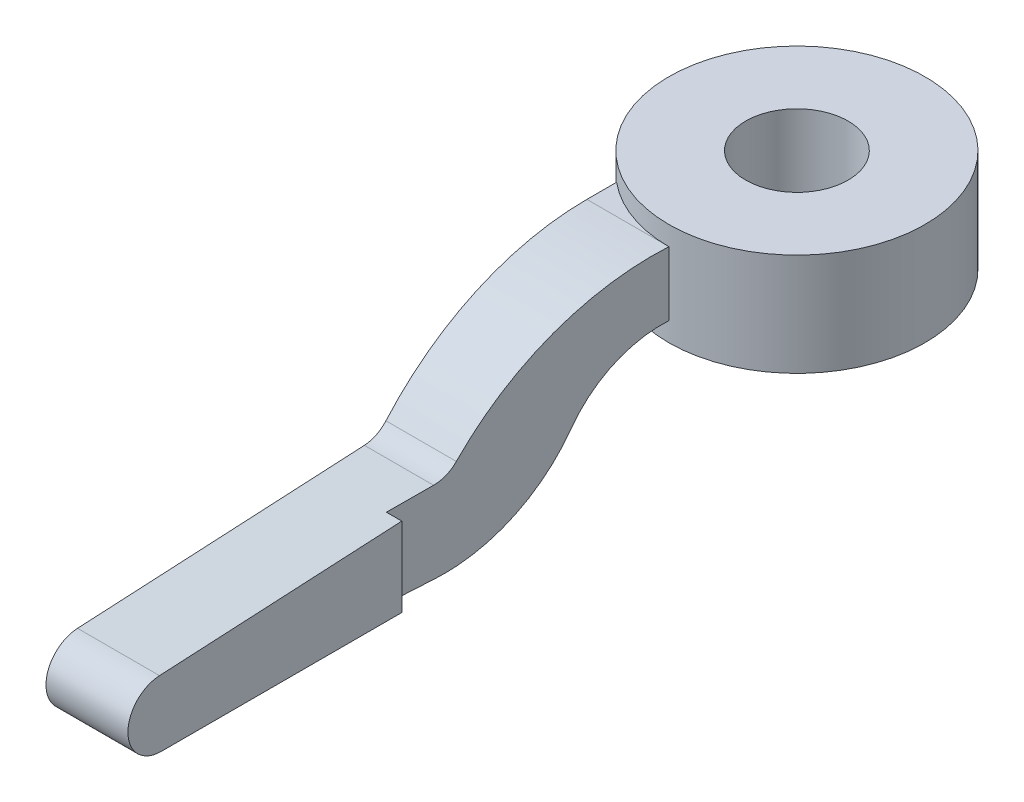
from build123d import *

# Parameters (mm, degrees)
SKETCH1_R           = 2.5
SKETCH1_R_2         = 1
BOSS_EXTRUDE1_DEPTH = 2
BOSS_EXTRUDE2_DEPTH = 0.8
CUT_EXTRUDE1_DEPTH  = 14.872182458


with BuildPart() as part:
    # Sketch1 → Boss-Extrude1 (new body)
    with BuildSketch(Plane(origin=(0, 0, 0), x_dir=(1, 0, 0), z_dir=(0, 1, 0))):
        with Locations(Location((0, 0, 0), (0, 0, 270))):
            Circle(SKETCH1_R)
        with Locations(Location((0, 0, 0), (0, 0, 270))):
            Circle(SKETCH1_R_2, mode=Mode.SUBTRACT)
    extrude(amount=BOSS_EXTRUDE1_DEPTH)

    # Sketch7 → Boss-Extrude2 (add, symmetric)
    with BuildSketch(Plane(origin=(-0.8, 0, 0), x_dir=(0, -1, 0), z_dir=(-1, 0, 0))):
        with BuildLine():
            Line((1.954019719, 6.809600844), (1.954019719, 12.409600844))
            ThreePointArc((1.954019719, 12.409600844), (1.321034736, 13.059378105), (0.654910522, 12.443619215))
            Line((0.654910522, 12.443619215), (0.361426958, 6.843619215))
            ThreePointArc((0.361426958, 6.843619215), (0.301852122, 6.612668496), (0.157008946, 6.423174828))
            ThreePointArc((0.157008946, 6.423174828), (-1.158621723, 4.654463774), (-1.625, 2.5))
            Line((-1.625, 2.5), (-1.625, 1.75))
            Line((-1.625, 1.75), (-0.375, 1.75))
            Line((-0.375, 1.75), (-0.375, 2.5))
            ThreePointArc((-0.375, 2.5), (-0.11625091, 3.523019396), (0.597766538, 4.3))
            ThreePointArc((0.597766538, 4.3), (1.593265867, 5.383283989), (1.954019719, 6.809600844))
        make_face()
    extrude(amount=BOSS_EXTRUDE2_DEPTH, both=True)

    # Sketch9 → Cut-Extrude1 (cut, through all)
    with BuildSketch(Plane.XZ.offset(1.954019719)):
        Polygon((0, 2.5), (-0.3, 7.71372429), (0, 7.71372429), align=None)
    extrude(amount=-CUT_EXTRUDE1_DEPTH, mode=Mode.SUBTRACT)


solid = part.part
